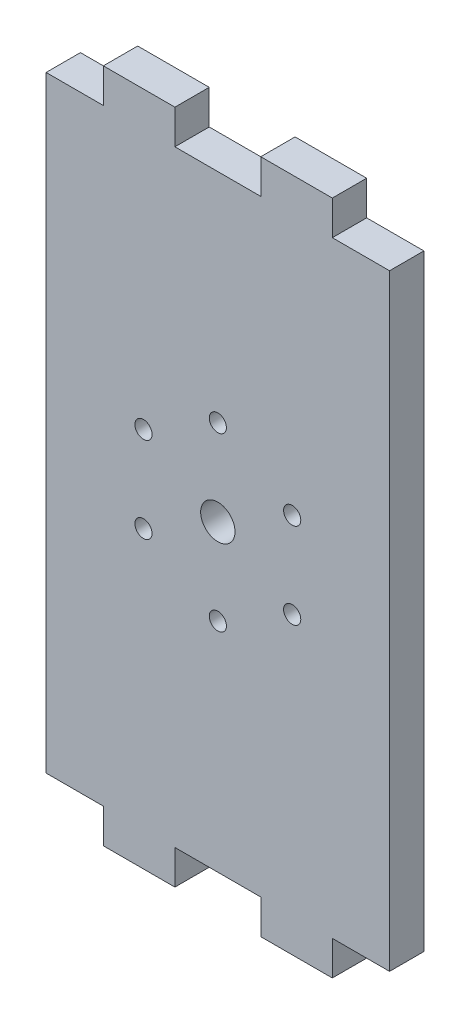
from build123d import *

# Parameters (mm, degrees)
SKETCH1_R           = 0.75
SKETCH1_R_2         = 1.5
BOSS_EXTRUDE1_DEPTH = 3


with BuildPart() as part:
    # Sketch1 → Boss-Extrude1 (new body)
    with BuildSketch(Plane.XY):
        Polygon((-15, 26.5), (-10, 26.5), (-10, 29.5), (-3.75, 29.5), (-3.75, 26.5), (3.75, 26.5), (3.75, 29.5), (10, 29.5), (10, 26.5), (15, 26.5), (15, -26.5), (10, -26.5), (10, -29.5), (3.75, -29.5), (3.75, -26.5), (-3.75, -26.5), (-3.75, -29.5), (-10, -29.5), (-10, -26.5), (-15, -26.5), align=None)
        with Locations((0, 7.5)):
            Circle(SKETCH1_R, mode=Mode.SUBTRACT)
        with Locations((6.495190528, 3.75)):
            Circle(SKETCH1_R, mode=Mode.SUBTRACT)
        with Locations((6.495190528, -3.75)):
            Circle(SKETCH1_R, mode=Mode.SUBTRACT)
        with Locations((0, -7.5)):
            Circle(SKETCH1_R, mode=Mode.SUBTRACT)
        with Locations((-6.495190528, -3.75)):
            Circle(SKETCH1_R, mode=Mode.SUBTRACT)
        with Locations((-6.495190528, 3.75)):
            Circle(SKETCH1_R, mode=Mode.SUBTRACT)
        Circle(SKETCH1_R_2, mode=Mode.SUBTRACT)
    extrude(amount=BOSS_EXTRUDE1_DEPTH)


solid = part.part
